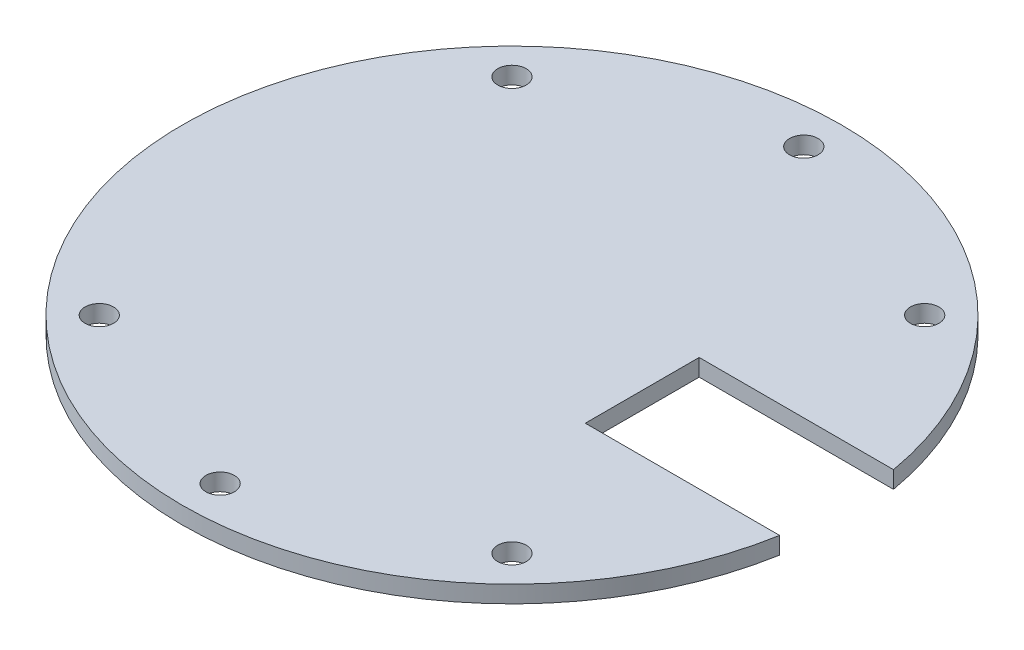
from build123d import *

# Parameters (mm, degrees)
SKETCH_1_R          = 23.15
EXTRUDE_1_DEPTH     = 1.2
SKETCH_2_R          = 1
CUT_EXTRUDE_1_DEPTH = 1.6


with BuildPart() as part:
    # 草图1 → 凸台-拉伸1 (new body)
    with BuildSketch(Plane(origin=(0, 0, 0), x_dir=(1, 0, 0), z_dir=(0, 1, 0))):
        with Locations(Location((0, 0, 0), (0, 0, 270))):
            Circle(SKETCH_1_R)
    extrude(amount=EXTRUDE_1_DEPTH)

    # 草图2 → 切除-拉伸1 (cut)
    with BuildSketch(Plane(origin=(0, 1.2, 0), x_dir=(1, 0, 0), z_dir=(0, 1, 0))):
        with Locations(Location((0, 20.5, 0), (0, 0, 270))):
            Circle(SKETCH_2_R)
        with Locations(Location((14.495689014, 14.495689014, 0), (0, 0, 270))):
            Circle(SKETCH_2_R)
        with Locations(Location((14.495689014, -14.495689014, 0), (0, 0, 270))):
            Circle(SKETCH_2_R)
        with Locations(Location((0, -20.5, 0), (0, 0, 270))):
            Circle(SKETCH_2_R)
        with Locations(Location((-14.495689014, -14.495689014, 0), (0, 0, 270))):
            Circle(SKETCH_2_R)
        with Locations(Location((-14.495689014, 14.495689014, 0), (0, 0, 270))):
            Circle(SKETCH_2_R)
        Polygon((23.15, 0), (23.15, 4), (9.15, 4), (9.15, -4), (23.15, -4), align=None)
    extrude(amount=-CUT_EXTRUDE_1_DEPTH, mode=Mode.SUBTRACT)


solid = part.part
